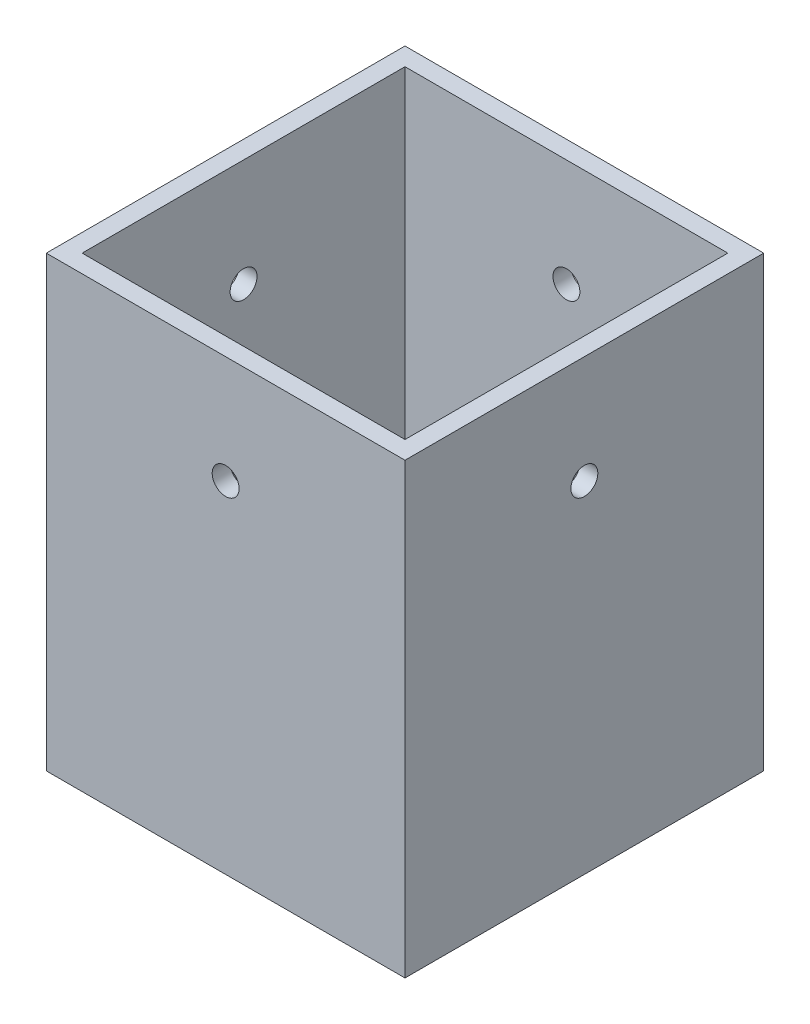
from build123d import *

# Parameters (mm, degrees)
SKETCH_1_W          = 40
SKETCH_1_H          = 40
EXTRUDE_1_DEPTH     = 50
SKETCH_2_W          = 36
SKETCH_2_H          = 36
CUT_EXTRUDE_1_DEPTH = 46
SKETCH_3_R          = 1.5
CUT_EXTRUDE_2_DEPTH = 46
SKETCH_4_R          = 1.5
CUT_EXTRUDE_3_DEPTH = 46


with BuildPart() as part:
    # 草图1 → 凸台-拉伸1 (new body)
    with BuildSketch(Plane(origin=(0, 0, 0), x_dir=(1, 0, 0), z_dir=(0, 1, 0))):
        with Locations((20, -20)):
            Rectangle(SKETCH_1_W, SKETCH_1_H)
    extrude(amount=EXTRUDE_1_DEPTH)

    # 草图2 → 切除-拉伸1 (cut)
    with BuildSketch(Plane(origin=(0, 50, 0), x_dir=(1, 0, 0), z_dir=(0, 1, 0))):
        with Locations((20, -20)):
            Rectangle(SKETCH_2_W, SKETCH_2_H)
    extrude(amount=-CUT_EXTRUDE_1_DEPTH, mode=Mode.SUBTRACT)

    # 草图3 → 切除-拉伸2 (cut)
    with BuildSketch(Plane.XY.offset(40)):
        with Locations((20, 38)):
            Circle(SKETCH_3_R)
    extrude(amount=-CUT_EXTRUDE_2_DEPTH, mode=Mode.SUBTRACT)

    # 草图4 → 切除-拉伸3 (cut)
    with BuildSketch(Plane(origin=(40, 0, 0), x_dir=(0, 0, -1), z_dir=(1, 0, 0))):
        with Locations((-20, 38)):
            Circle(SKETCH_4_R)
    extrude(amount=-CUT_EXTRUDE_3_DEPTH, mode=Mode.SUBTRACT)


solid = part.part
